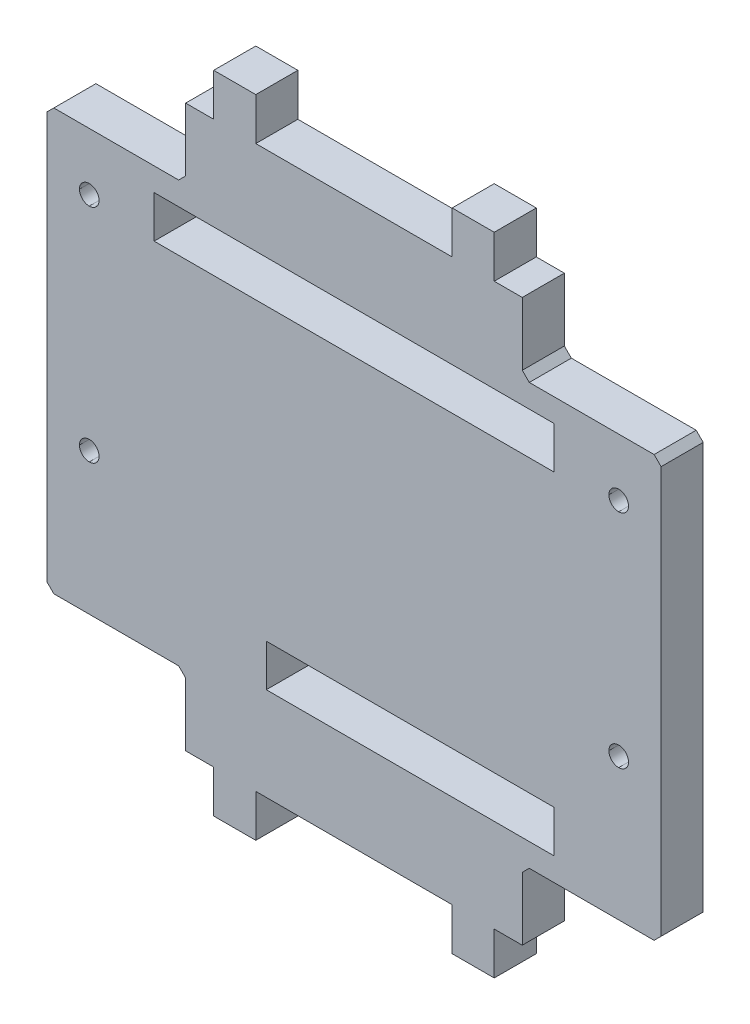
from build123d import *

# Parameters (mm, degrees)
SALIENTE_EXTRUIR1_DEPTH = 6


with BuildPart() as part:
    # Corte → Saliente-Extruir1 (new body)
    with BuildSketch(Plane.XY):
        Polygon((113.99992211, 146.05), (113.999928646, 140), (86.000028142, 140), (86.000028142, 146.05), (80.000028142, 146.05), (80.000028142, 140), (76.000028142, 140), (76.000028142, 131.000000972), (75.000028142, 130.000001013), (57.20005465, 130.000001734), (56.20005465, 129.000001774), (56.20005465, 71.000001774), (57.20005465, 70.000001734), (75.000028142, 70.000001013), (76.000028142, 69.000000972), (76.000028142, 60), (80.000028142, 60), (80.000028142, 53.95), (86.000028142, 53.95), (86.000028142, 60), (114.00001507, 60), (114.000021606, 53.95), (120.000021606, 53.95), (120.00001507, 60), (124.00001507, 60), (124.000005347, 68.999999028), (125.000004267, 69.999998987), (142.80005465, 69.999998266), (143.80005465, 70.999998226), (143.80005465, 128.999998226), (142.80005465, 129.999998266), (124.999939449, 129.999998987), (123.999938369, 130.999999028), (123.999928646, 140), (119.999928646, 140), (119.99992211, 146.05), align=None)
        Polygon((71.50005465, 126.700001641), (128.50005465, 126.699998845), (128.50005465, 120.699998845), (71.50005465, 120.700001155), align=None, mode=Mode.SUBTRACT)
        Polygon((87.50005465, 73.300000506), (128.50005465, 73.299998359), (128.50005465, 79.299998845), (87.50005465, 79.300000506), align=None, mode=Mode.SUBTRACT)
        with BuildLine():
            add(Edge.make_bspline(
                [(139.147057668, 90.199998471), (139.147059335, 89.428473471), (138.521585686, 88.802997119), (137.750060686, 88.802995452)],
                knots=[0, 0, 0, 0, 1, 1, 1, 1], degree=3))
            add(Edge.make_bspline(
                [(137.750060686, 88.802995452), (136.978535686, 88.802993785), (136.353059335, 89.428467434), (136.353057668, 90.199992434)],
                knots=[0, 0, 0, 0, 1, 1, 1, 1], degree=3))
            add(Edge.make_bspline(
                [(136.353057668, 90.199992434), (136.353056001, 90.971517434), (136.97852965, 91.596993785), (137.75005465, 91.596995452)],
                knots=[0, 0, 0, 0, 1, 1, 1, 1], degree=3))
            add(Edge.make_bspline(
                [(137.75005465, 91.596995452), (138.52157965, 91.596997119), (139.147056001, 90.971523471), (139.147057668, 90.199998471)],
                knots=[0, 0, 0, 0, 1, 1, 1, 1], degree=3))
        make_face(mode=Mode.SUBTRACT)
        with BuildLine():
            add(Edge.make_bspline(
                [(139.147057668, 121.799998471), (139.147059335, 121.028473471), (138.521585686, 120.402997119), (137.750060686, 120.402995452)],
                knots=[0, 0, 0, 0, 1, 1, 1, 1], degree=3))
            add(Edge.make_bspline(
                [(137.750060686, 120.402995452), (136.978535686, 120.402993785), (136.353059335, 121.028467434), (136.353057668, 121.799992434)],
                knots=[0, 0, 0, 0, 1, 1, 1, 1], degree=3))
            add(Edge.make_bspline(
                [(136.353057668, 121.799992434), (136.353056001, 122.571517434), (136.97852965, 123.196993785), (137.75005465, 123.196995452)],
                knots=[0, 0, 0, 0, 1, 1, 1, 1], degree=3))
            add(Edge.make_bspline(
                [(137.75005465, 123.196995452), (138.52157965, 123.196997119), (139.147056001, 122.571523471), (139.147057668, 121.799998471)],
                knots=[0, 0, 0, 0, 1, 1, 1, 1], degree=3))
        make_face(mode=Mode.SUBTRACT)
        with BuildLine():
            add(Edge.make_bspline(
                [(63.647057668, 121.800001529), (63.647059335, 121.028476529), (63.021585686, 120.403000178), (62.250060686, 120.402998511)],
                knots=[0, 0, 0, 0, 1, 1, 1, 1], degree=3))
            add(Edge.make_bspline(
                [(62.250060686, 120.402998511), (61.478535686, 120.402996844), (60.853059335, 121.028470493), (60.853057668, 121.799995493)],
                knots=[0, 0, 0, 0, 1, 1, 1, 1], degree=3))
            add(Edge.make_bspline(
                [(60.853057668, 121.799995493), (60.853056001, 122.571520493), (61.47852965, 123.196996844), (62.25005465, 123.196998511)],
                knots=[0, 0, 0, 0, 1, 1, 1, 1], degree=3))
            add(Edge.make_bspline(
                [(62.25005465, 123.196998511), (63.02157965, 123.197000178), (63.647056001, 122.571526529), (63.647057668, 121.800001529)],
                knots=[0, 0, 0, 0, 1, 1, 1, 1], degree=3))
        make_face(mode=Mode.SUBTRACT)
        with BuildLine():
            add(Edge.make_bspline(
                [(63.647057668, 90.200001529), (63.647059335, 89.428476529), (63.021585686, 88.803000178), (62.250060686, 88.802998511)],
                knots=[0, 0, 0, 0, 1, 1, 1, 1], degree=3))
            add(Edge.make_bspline(
                [(62.250060686, 88.802998511), (61.478535686, 88.802996844), (60.853059335, 89.428470493), (60.853057668, 90.199995493)],
                knots=[0, 0, 0, 0, 1, 1, 1, 1], degree=3))
            add(Edge.make_bspline(
                [(60.853057668, 90.199995493), (60.853056001, 90.971520493), (61.47852965, 91.596996844), (62.25005465, 91.596998511)],
                knots=[0, 0, 0, 0, 1, 1, 1, 1], degree=3))
            add(Edge.make_bspline(
                [(62.25005465, 91.596998511), (63.02157965, 91.597000178), (63.647056001, 90.971526529), (63.647057668, 90.200001529)],
                knots=[0, 0, 0, 0, 1, 1, 1, 1], degree=3))
        make_face(mode=Mode.SUBTRACT)
    extrude(amount=-SALIENTE_EXTRUIR1_DEPTH)


solid = part.part
